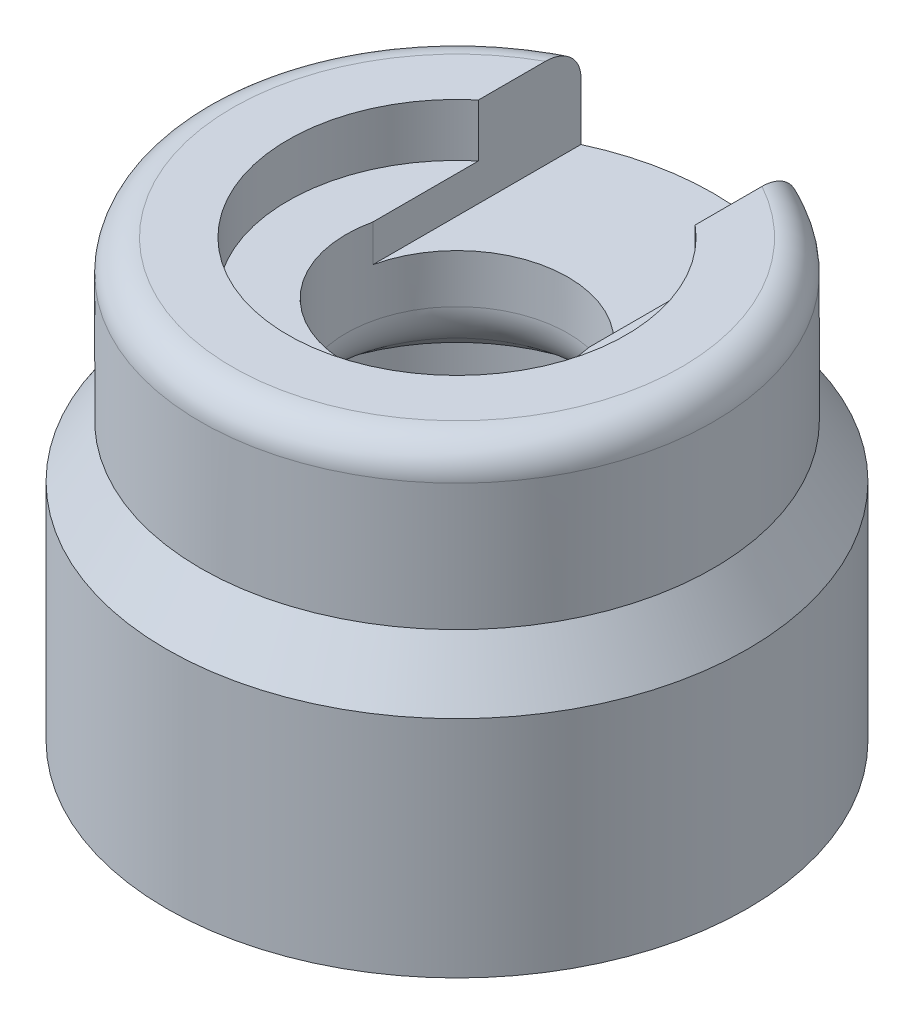
from build123d import *

# Parameters (mm, degrees)
CROQUIS1_R              = 5.5
CROQUIS1_R_2            = 3.225
SALIENTE_EXTRUIR1_DEPTH = 4.25
CROQUIS3_R              = 4.85
CROQUIS3_R_2            = 2.1
SALIENTE_EXTRUIR2_DEPTH = 3
REDONDEO1_R             = 0.6
CROQUIS4_R              = 3.2
CORTAR_EXTRUIR1_DEPTH   = 1
CORTAR_EXTRUIR2_START   = -0.7
CROQUIS5_W              = 4.1
CROQUIS5_H              = 5
CORTAR_EXTRUIR2_DEPTH   = 12.333085159
REDONDEO2_R             = 1
REDONDEO3_R             = 0.75


with BuildPart() as part:
    # Croquis1 → Saliente-Extruir1 (new body)
    with BuildSketch(Plane(origin=(0, 0, 0), x_dir=(1, 0, 0), z_dir=(0, 1, 0))):
        with Locations(Location((0, 0, 0), (0, 0, 270))):
            Circle(CROQUIS1_R)
        with Locations(Location((0, 0, 0), (0, 0, 270))):
            Circle(CROQUIS1_R_2, mode=Mode.SUBTRACT)
    extrude(amount=SALIENTE_EXTRUIR1_DEPTH)

    # Croquis2 → Revolución1 (revolve)
    with BuildSketch(Plane.XY, mode=Mode.PRIVATE) as revoluci_n1_sk:
        Polygon((-5.5, 4.25), (-4.85, 5.25), (-2.1, 5.25), (-2.1, 5.15), (-3.225, 4.25), align=None)
    revolve(revoluci_n1_sk.sketch.rotate(Axis((0, 0, 0), (0, 1, 0)), 270), axis=Axis((0, 0, 0), (0, 1, 0)))

    # Croquis3 → Saliente-Extruir2 (add)
    with BuildSketch(Plane(origin=(0, 5.25, 0), x_dir=(1, 0, 0), z_dir=(0, 1, 0))):
        with Locations(Location((0, 0, 0), (0, 0, 270))):
            Circle(CROQUIS3_R)
        with Locations(Location((0, 0, 0), (0, 0, 90))):
            Circle(CROQUIS3_R_2, mode=Mode.SUBTRACT)
    extrude(amount=SALIENTE_EXTRUIR2_DEPTH)

    # Redondeo1
    redondeo1_edges = [part.edges().sort_by_distance(p)[0] for p in [
        (0, 8.25, -4.85),
    ]]
    fillet(redondeo1_edges, radius=REDONDEO1_R)

    # Croquis4 → Cortar-Extruir1 (cut)
    with BuildSketch(Plane(origin=(0, 8.25, 0), x_dir=(1, 0, 0), z_dir=(0, 1, 0))):
        with Locations(Location((0, 0, 0), (0, 0, 270))):
            Circle(CROQUIS4_R)
    extrude(amount=-CORTAR_EXTRUIR1_DEPTH, mode=Mode.SUBTRACT)

    # Croquis5 → Cortar-Extruir2 (cut, through all)
    with BuildSketch(Plane(origin=(0, 7.25, 0), x_dir=(1, 0, 0), z_dir=(0, 1, 0)).offset(CORTAR_EXTRUIR2_START)):
        with Locations((0, 2.503070431)):
            Rectangle(CROQUIS5_W, CROQUIS5_H)
    extrude(amount=CORTAR_EXTRUIR2_DEPTH, mode=Mode.SUBTRACT)

    # Redondeo2
    redondeo2_edges = [part.edges().sort_by_distance(p)[0] for p in [
        (0, 5.15, 2.1),
    ]]
    fillet(redondeo2_edges, radius=REDONDEO2_R)

    # Redondeo3
    redondeo3_edges = [part.edges().sort_by_distance(p)[0] for p in [
        (0, 0, -3.225),
    ]]
    fillet(redondeo3_edges, radius=REDONDEO3_R)


solid = part.part
